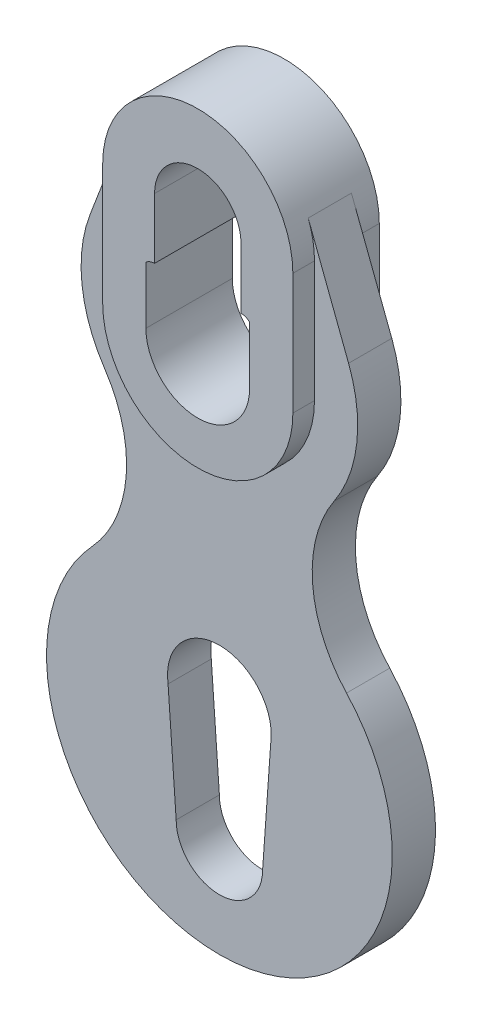
from build123d import *

# Parameters (mm, degrees)
BOSS_EXTRUDE1_DEPTH = 10
BOSS_EXTRUDE2_DEPTH = 5


with BuildPart() as part:
    # Sketch1 → Boss-Extrude1 (new, symmetric)
    with BuildSketch(Plane.XY):
        with BuildLine():
            ThreePointArc((20.54909502, 117.857142857), (0, 132), (-20.54909502, 117.857142857))
            ThreePointArc((-20.54909502, 117.857142857), (-21.634233178, 113.994991212), (-22, 110))
            Line((-22, 110), (-22, 82))
            ThreePointArc((-22, 82), (0, 60), (22, 82))
            Line((22, 82), (22, 110))
            ThreePointArc((22, 110), (21.634233178, 113.994991212), (20.54909502, 117.857142857))
        make_face()
        with BuildLine():
            Line((-12, 82), (-12, 95.236067977))
            ThreePointArc((-12, 95.236067977), (-11.070466269, 95.802517077), (-10, 96))
            Line((-10, 96), (-10, 110))
            ThreePointArc((-10, 110), (0, 120), (10, 110))
            Line((10, 110), (10, 96))
            ThreePointArc((10, 96), (11.070466269, 95.802517077), (12, 95.236067977))
            Line((12, 95.236067977), (12, 82))
            ThreePointArc((12, 82), (0, 70), (-12, 82))
        make_face(mode=Mode.SUBTRACT)
    extrude(amount=BOSS_EXTRUDE1_DEPTH, both=True)

    # Sketch1<3> → Boss-Extrude2 (add, symmetric)
    with BuildSketch(Plane.XY):
        with BuildLine():
            Line((-20.54909502, 117.857142857), (-29.889592756, 93.428571429))
            ThreePointArc((-29.889592756, 93.428571429), (-31.795758241, 78.390324411), (-26.567056796, 64.162077105))
            ThreePointArc((-26.567056796, 64.162077105), (-21.561800954, 45.141212789), (-29.413527167, 27.108013937))
            ThreePointArc((-29.413527167, 27.108013937), (0, -40), (29.413527167, 27.108013937))
            ThreePointArc((29.413527167, 27.108013937), (21.561800954, 45.141212789), (26.567056796, 64.162077105))
            ThreePointArc((26.567056796, 64.162077105), (31.795758241, 78.390324411), (29.889592756, 93.428571429))
            Line((29.889592756, 93.428571429), (20.54909502, 117.857142857))
            ThreePointArc((20.54909502, 117.857142857), (21.634233178, 113.994991212), (22, 110))
            Line((22, 110), (22, 82))
            ThreePointArc((22, 82), (0, 60), (-22, 82))
            Line((-22, 82), (-22, 110))
            ThreePointArc((-22, 110), (-21.634233178, 113.994991212), (-20.54909502, 117.857142857))
        make_face()
        with BuildLine():
            ThreePointArc((-11.878172589, 8.294416244), (-11.969504398, 9.1450354), (-12, 10))
            ThreePointArc((-12, 10), (0, 22), (12, 10))
            ThreePointArc((12, 10), (11.969504398, 9.1450354), (11.878172589, 8.294416244))
            Line((11.878172589, 8.294416244), (10, -18))
            ThreePointArc((10, -18), (0, -28), (-10, -18))
            Line((-10, -18), (-11.878172589, 8.294416244))
        make_face(mode=Mode.SUBTRACT)
    extrude(amount=BOSS_EXTRUDE2_DEPTH, both=True)


solid = part.part
